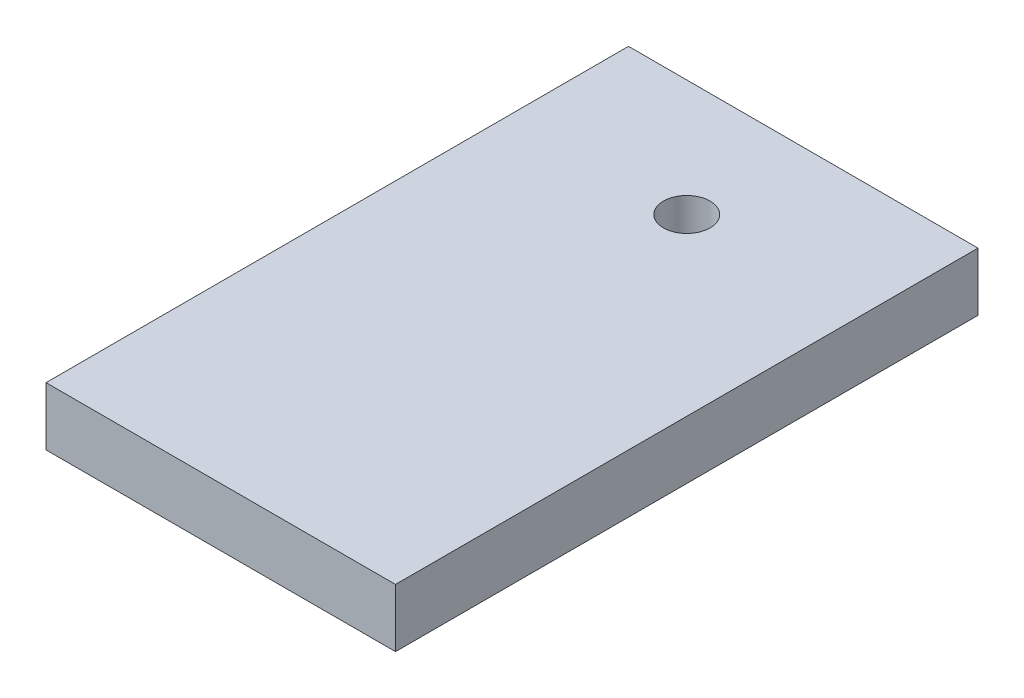
from build123d import *

# Parameters (mm, degrees)
SKETCH1_W           = 15.24
SKETCH1_H           = 25.4
BOSS_EXTRUDE1_DEPTH = 2.54
SKETCH2_R           = 1.016
CUT_EXTRUDE1_DEPTH  = 30.729937773


with BuildPart() as part:
    # Sketch1 → Boss-Extrude1 (new body)
    with BuildSketch(Plane(origin=(0, 0, 0), x_dir=(1, 0, 0), z_dir=(0, 1, 0))):
        with Locations((7.62, -12.7)):
            Rectangle(SKETCH1_W, SKETCH1_H)
    extrude(amount=-BOSS_EXTRUDE1_DEPTH)

    # Sketch2 → Cut-Extrude1 (cut, through all)
    with BuildSketch(Plane(origin=(0, 0, 0), x_dir=(1, 0, 0), z_dir=(0, 1, 0))):
        with Locations(Location((7.62, -5.08, 0), (0, 0, 270))):
            Circle(SKETCH2_R)
    extrude(amount=-CUT_EXTRUDE1_DEPTH, mode=Mode.SUBTRACT)


solid = part.part
